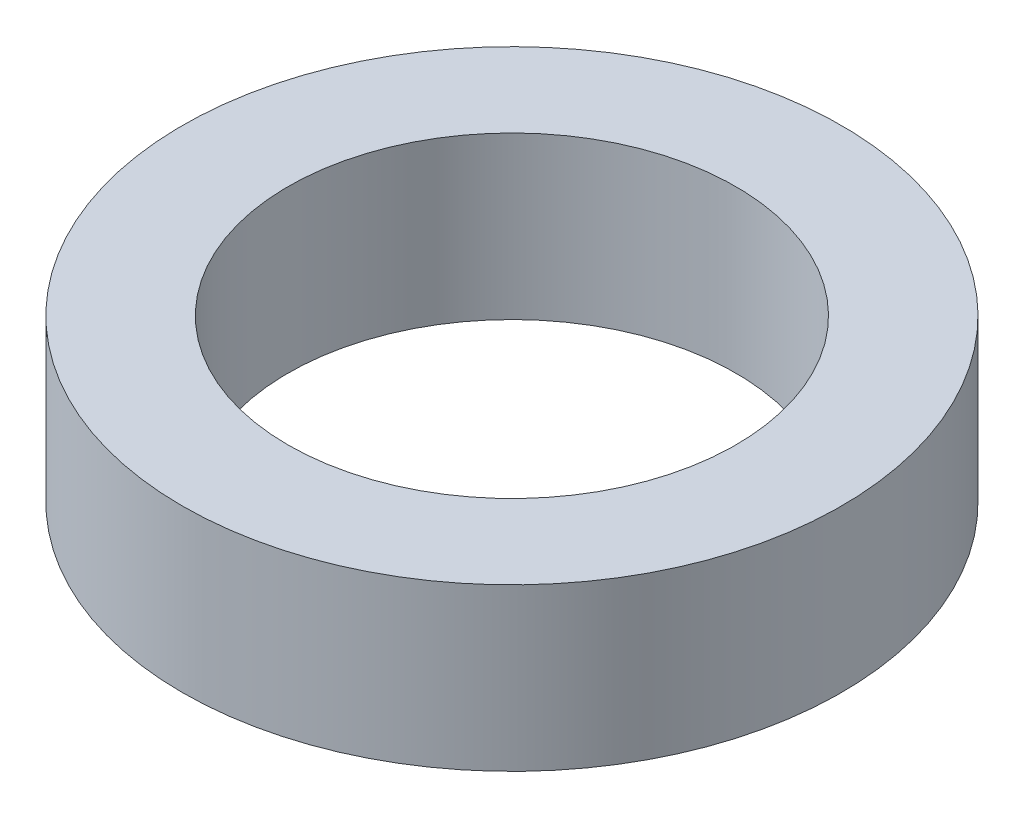
from build123d import *

# Parameters (mm, degrees)
SKETCH1_R           = 6.731
SKETCH1_R_2         = 4.572
BOSS_EXTRUDE1_DEPTH = 3.3


with BuildPart() as part:
    # Sketch1 → Boss-Extrude1 (new body)
    with BuildSketch(Plane(origin=(0, 0, 0), x_dir=(1, 0, 0), z_dir=(0, 1, 0))):
        with Locations(Location((0, 0, 0), (0, 0, 270))):
            Circle(SKETCH1_R)
        with Locations(Location((0, 0, 0), (0, 0, 270))):
            Circle(SKETCH1_R_2, mode=Mode.SUBTRACT)
    extrude(amount=BOSS_EXTRUDE1_DEPTH)


solid = part.part
